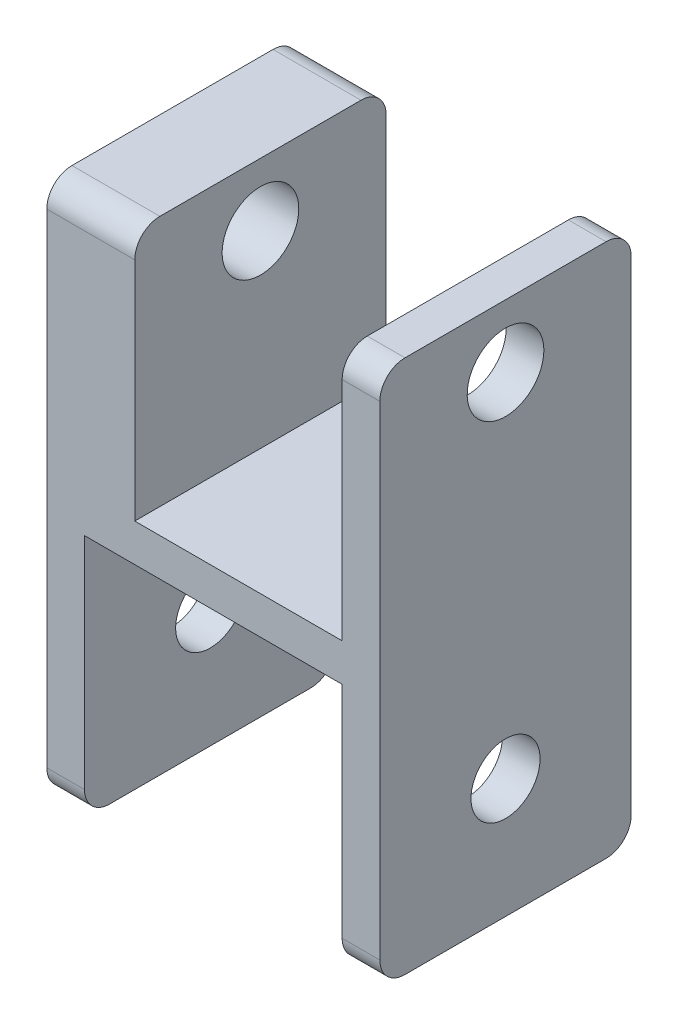
from build123d import *

# Parameters (mm, degrees)
BOSS_EXTRUDE1_DEPTH = 20
SKETCH2_R           = 2.75
SKETCH2_R_2         = 3.05
CUT_EXTRUDE1_DEPTH  = 40.553760883
BOSS_EXTRUDE2_START = 4
SKETCH3_W           = 20
SKETCH3_H           = 20
SKETCH3_R           = 3.05
BOSS_EXTRUDE2_DEPTH = 4
FILLET1_R           = 2


with BuildPart() as part:
    # Sketch1 → Boss-Extrude1 (new body)
    with BuildSketch(Plane.XY):
        Polygon((-10.25, 1.5), (10.25, 1.5), (10.25, 21.5), (13.25, 21.5), (13.25, -21), (10.25, -21), (10.25, -1.5), (-10.25, -1.5), (-10.25, -21), (-13.25, -21), (-13.25, 21.5), (-10.25, 21.5), align=None)
    extrude(amount=BOSS_EXTRUDE1_DEPTH)

    # Sketch2 → Cut-Extrude1 (cut, through all)
    with BuildSketch(Plane(origin=(13.25, 0, 0), x_dir=(0, 0, -1), z_dir=(1, 0, 0))):
        with Locations(Location((-10, -11.5, 0), (0, 0, 90))):
            Circle(SKETCH2_R)
        with Locations(Location((-10, 16.5, 0), (0, 0, 90))):
            Circle(SKETCH2_R_2)
    extrude(amount=-CUT_EXTRUDE1_DEPTH, mode=Mode.SUBTRACT)

    # Sketch3 → Boss-Extrude2 (add)
    with BuildSketch(Plane(origin=(-10.25, 0, 0), x_dir=(0, 0, -1), z_dir=(1, 0, 0)).offset(BOSS_EXTRUDE2_START)):
        with Locations((-10, 11.5)):
            Rectangle(SKETCH3_W, SKETCH3_H)
        with Locations(Location((-10, 16.5, 0), (0, 0, 90))):
            Circle(SKETCH3_R, mode=Mode.SUBTRACT)
    extrude(amount=-BOSS_EXTRUDE2_DEPTH)

    # Fillet1
    fillet1_edges = [part.edges().sort_by_distance(p)[0] for p in [
        (-9.75, 21.5, 0),
        (11.75, 21.5, 0),
        (11.75, -21, 0),
        (-11.75, -21, 0),
        (11.75, -21, 20),
        (11.75, 21.5, 20),
        (-9.75, 21.5, 20),
        (-11.75, -21, 20),
    ]]
    fillet(fillet1_edges, radius=FILLET1_R)


solid = part.part
